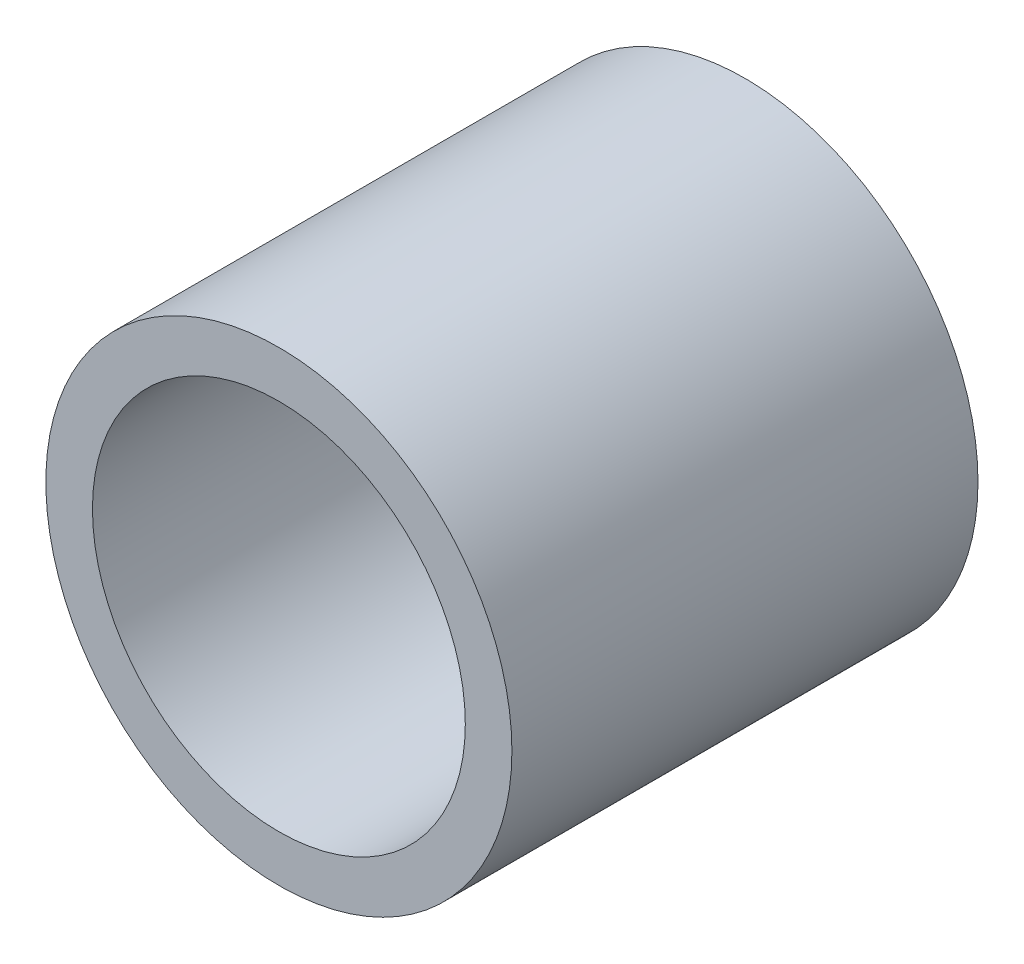
from build123d import *

# Parameters (mm, degrees)
SKETCH1_R           = 7.9375
SKETCH1_R_2         = 6.35
BOSS_EXTRUDE1_DEPTH = 7.9375


with BuildPart() as part:
    # Sketch1 → Boss-Extrude1 (new, symmetric)
    with BuildSketch(Plane.XY):
        Circle(SKETCH1_R)
        Circle(SKETCH1_R_2, mode=Mode.SUBTRACT)
    extrude(amount=BOSS_EXTRUDE1_DEPTH, both=True)


solid = part.part
